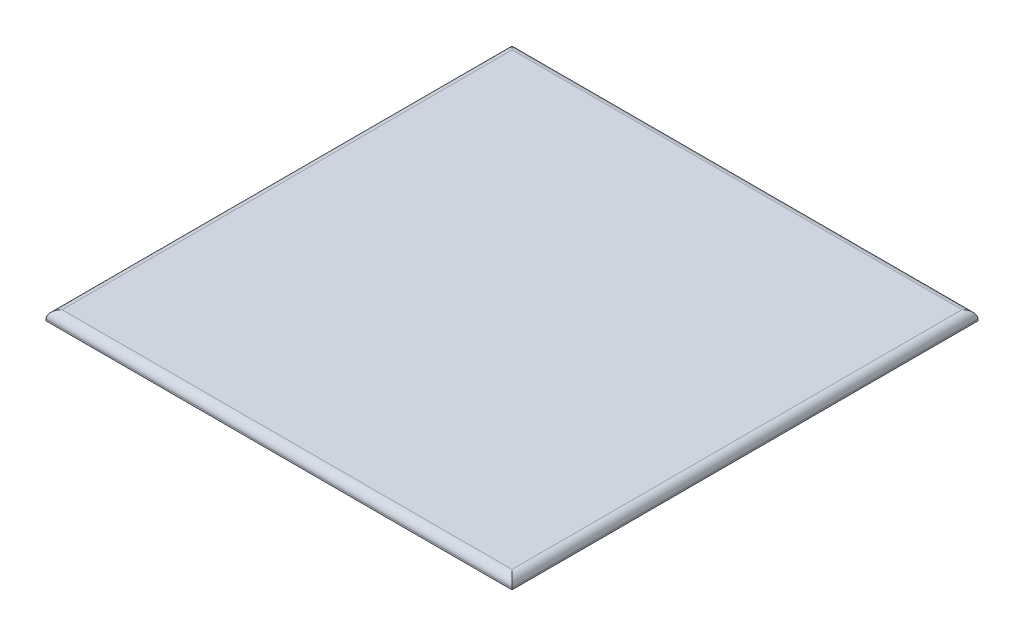
from build123d import *

# Parameters (mm, degrees)
SKETCH1_W           = 145
SKETCH1_H           = 145
BOSS_EXTRUDE1_DEPTH = 3
FILLET1_R           = 2.5
SKETCH2_W           = 25
SKETCH2_H           = 15
CUT_EXTRUDE1_DEPTH  = 1


with BuildPart() as part:
    # Sketch1 → Boss-Extrude1 (new body)
    with BuildSketch(Plane(origin=(0, 0, 0), x_dir=(1, 0, 0), z_dir=(0, 1, 0))):
        with Locations((72.5, 72.5)):
            Rectangle(SKETCH1_W, SKETCH1_H)
    extrude(amount=BOSS_EXTRUDE1_DEPTH)

    # Fillet1
    fillet1_edges = [part.edges().sort_by_distance(p)[0] for p in [
        (145, 3, -72.5),
        (72.5, 3, -145),
        (0, 3, -72.5),
        (72.5, 3, 0),
    ]]
    fillet(fillet1_edges, radius=FILLET1_R)

    # Sketch2 → Cut-Extrude1 (cut)
    with BuildSketch(Plane.XZ):
        with Locations((72.5, -37.5)):
            Rectangle(SKETCH2_W, SKETCH2_H)
    extrude(amount=-CUT_EXTRUDE1_DEPTH, mode=Mode.SUBTRACT)


solid = part.part
